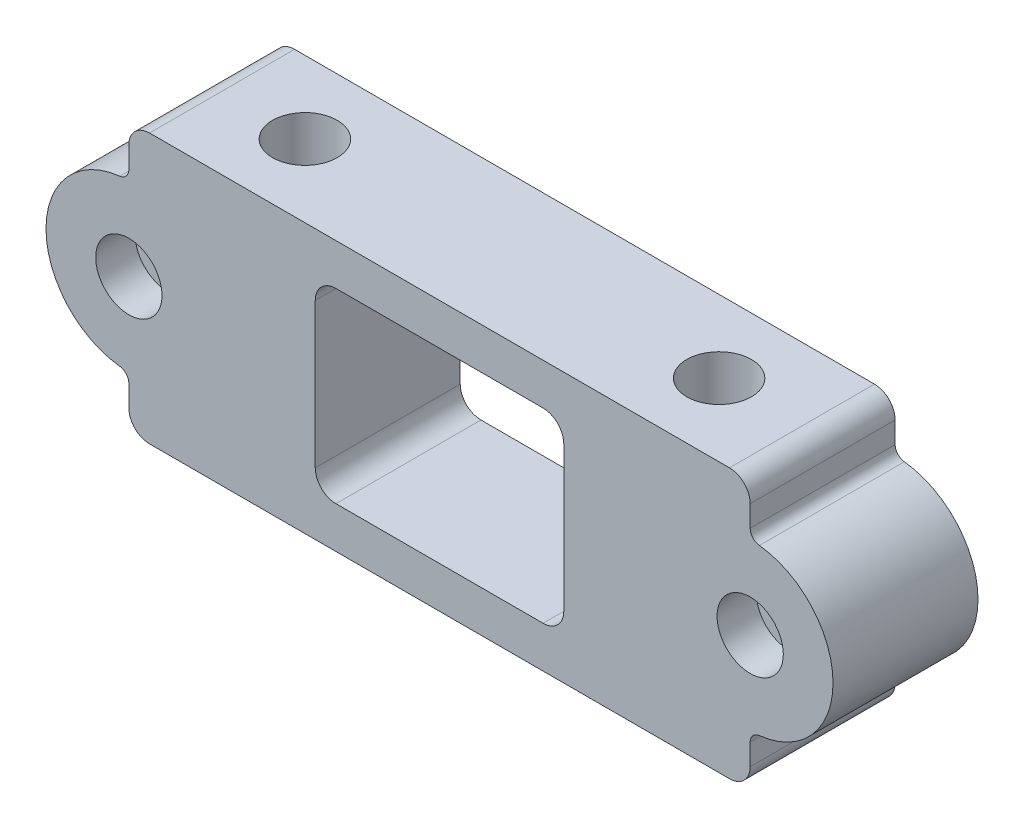
from build123d import *

# Parameters (mm, degrees)
SKETCH1_W           = 101.6
SKETCH1_H           = 17.78
SKETCH1_R           = 3.96875
BOSS_EXTRUDE1_DEPTH = 33.02
SKETCH2_R           = 2.4892
CUT_EXTRUDE1_DEPTH  = 17.78
SKETCH3_R           = 4.064
CUT_EXTRUDE2_DEPTH  = 4.826
CUT_EXTRUDE3_DEPTH  = 109.300548475
FILLET1_R           = 2.54
CUT_EXTRUDE4_DEPTH  = 106.921350067


with BuildPart() as part:
    # Sketch1 → Boss-Extrude1 (new body)
    with BuildSketch(Plane(origin=(0, 0, 0), x_dir=(1, 0, 0), z_dir=(0, 1, 0))):
        with Locations((50.8, 8.89)):
            Rectangle(SKETCH1_W, SKETCH1_H)
        with Locations(Location((76.2, 8.89, 0), (0, 0, 270))):
            Circle(SKETCH1_R, mode=Mode.SUBTRACT)
        with Locations(Location((25.4, 8.89, 0), (0, 0, 270))):
            Circle(SKETCH1_R, mode=Mode.SUBTRACT)
    extrude(amount=-BOSS_EXTRUDE1_DEPTH)

    # Sketch2 → Cut-Extrude1 (cut)
    with BuildSketch(Plane.XY):
        with Locations((88.9, -16.51)):
            Circle(SKETCH2_R)
        with Locations((12.7, -16.51)):
            Circle(SKETCH2_R)
    extrude(amount=-CUT_EXTRUDE1_DEPTH, mode=Mode.SUBTRACT)

    # Sketch3 → Cut-Extrude2 (cut)
    with BuildSketch(Plane.XY):
        with Locations((88.9, -16.51)):
            Circle(SKETCH3_R)
        with Locations((12.7, -16.51)):
            Circle(SKETCH3_R)
    extrude(amount=-CUT_EXTRUDE2_DEPTH, mode=Mode.SUBTRACT)

    # Sketch5 → Cut-Extrude3 (cut, through all)
    with BuildSketch(Plane.XY):
        with BuildLine():
            Line((12.7, -5.150774674), (12.7, 0))
            Line((12.7, 0), (0, 0))
            Line((0, 0), (0, -33.02))
            Line((0, -33.02), (12.7, -33.02))
            Line((12.7, -33.02), (12.7, -27.869225326))
            ThreePointArc((12.7, -27.869225326), (12.37660211, -27.022558659), (11.571111111, -26.607089178))
            ThreePointArc((11.571111111, -26.607089178), (2.54, -16.51), (11.571111111, -6.412910822))
            ThreePointArc((11.571111111, -6.412910822), (12.37660211, -5.997441341), (12.7, -5.150774674))
        make_face()
        with BuildLine():
            Line((88.9, -5.150774674), (88.9, 0))
            Line((88.9, 0), (101.6, 0))
            Line((101.6, 0), (101.6, -33.02))
            Line((101.6, -33.02), (88.9, -33.02))
            Line((88.9, -33.02), (88.9, -27.869225326))
            ThreePointArc((88.9, -27.869225326), (89.22339789, -27.022558659), (90.028888889, -26.607089178))
            ThreePointArc((90.028888889, -26.607089178), (99.06, -16.51), (90.028888889, -6.412910822))
            ThreePointArc((90.028888889, -6.412910822), (89.22339789, -5.997441341), (88.9, -5.150774674))
        make_face()
    extrude(amount=-CUT_EXTRUDE3_DEPTH, mode=Mode.SUBTRACT)

    # Fillet1
    fillet1_edges = [part.edges().sort_by_distance(p)[0] for p in [
        (12.7, -33.02, -8.89),
        (12.7, 0, -8.89),
        (88.9, 0, -8.89),
        (88.9, -33.02, -8.89),
    ]]
    fillet(fillet1_edges, radius=FILLET1_R)

    # Sketch6 → Cut-Extrude4 (cut, through all)
    with BuildSketch(Plane.XY):
        with BuildLine():
            Line((38.1, -27.94), (63.5, -27.94))
            ThreePointArc((63.5, -27.94), (65.296051224, -27.196051224), (66.04, -25.4))
            Line((66.04, -25.4), (66.04, -7.62))
            ThreePointArc((66.04, -7.62), (65.296051224, -5.823948776), (63.5, -5.08))
            Line((63.5, -5.08), (38.1, -5.08))
            ThreePointArc((38.1, -5.08), (36.303948776, -5.823948776), (35.56, -7.62))
            Line((35.56, -7.62), (35.56, -25.4))
            ThreePointArc((35.56, -25.4), (36.303948776, -27.196051224), (38.1, -27.94))
        make_face()
    extrude(amount=-CUT_EXTRUDE4_DEPTH, mode=Mode.SUBTRACT)


solid = part.part
